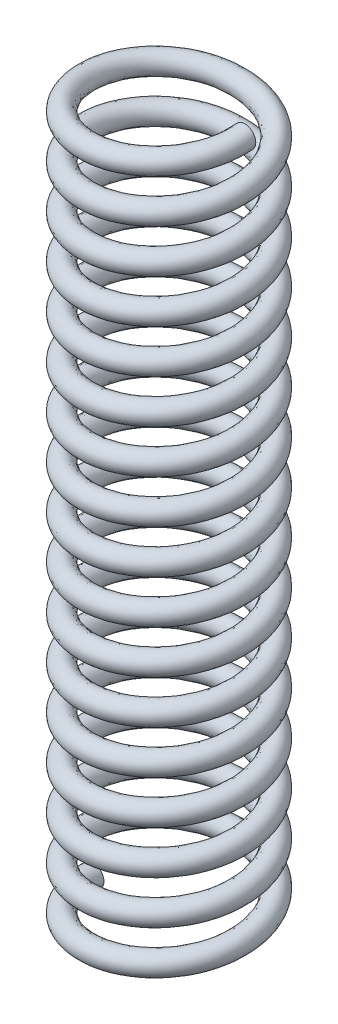
from build123d import *

# Parameters (mm, degrees)
SPRING_PITCH          = 1
SPRING_HEIGHT         = 16.5
SPRING_RADIUS         = 1.75
SPRING_START_ANGLE    = 90
SPRINGBODYDIAMETERS_R = 0.25


with BuildPart() as part:
    # SPRING: sweep along a helix
    with BuildLine() as spring_path:
        add(Helix(SPRING_PITCH, SPRING_HEIGHT, SPRING_RADIUS, center=(0, 0, 0), direction=(0, -1, 0), mode=Mode.PRIVATE).rotate(Axis((0, 0, 0), (0, -1, 0)), SPRING_START_ANGLE))
    # SpringBodyDiameterS → SPRING (sweep)
    with BuildSketch(Plane.XY):
        with Locations((1.75, 0)):
            Circle(SPRINGBODYDIAMETERS_R)
    sweep(path=spring_path.line, is_frenet=True)


solid = part.part
